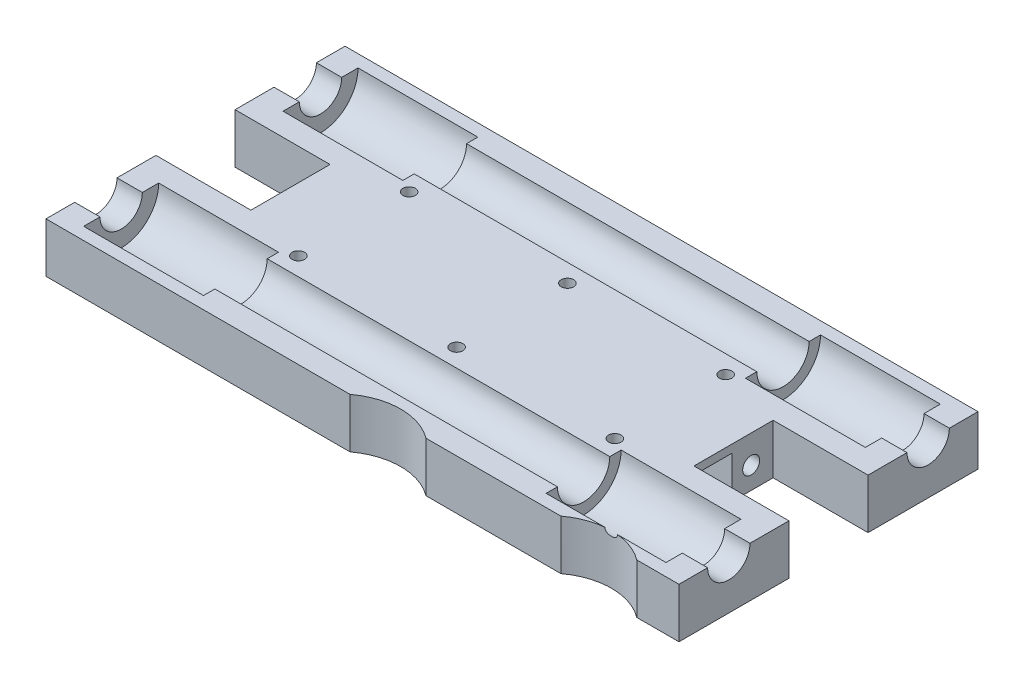
from build123d import *

# Parameters (mm, degrees)
SKETCH1_W                      = 127
SKETCH1_H                      = 60
BOSS_EXTRUDE1_DEPTH            = 10
CUT_EXTRUDE1_START             = -5.08
SKETCH3_R                      = 7.525
CUT_EXTRUDE1_DEPTH             = 24.05
CUT_EXTRUDE2_REACH             = 127.954
SKETCH4_R                      = 4.25
CUT_EXTRUDE2_DIRECTION_2_REACH = 127.954
CUT_EXTRUDE3_START             = -68.74
SKETCH5_R                      = 5.25
SKETCH5_R_2                    = 4.25
CUT_EXTRUDE3_DEPTH             = 68.74
SKETCH6_W                      = 15.875
SKETCH6_H                      = 10
CUT_EXTRUDE4_DEPTH             = 19.05
M3_CLEARANCE_HOLE1_D           = 3.4
CUT_EXTRUDE5_START             = -6.35
CUT_EXTRUDE5_DEPTH             = 5
M3X0_5_TAPPED_HOLE1_D          = 2.5
SKETCH12_W                     = 7.62
SKETCH12_H                     = 8.4125
CUT_EXTRUDE6_DEPTH             = 113.48645474
CUT_EXTRUDE7_REACH             = 72.938
SKETCH13_R                     = 12.7


with BuildPart() as part:
    # Sketch1 → Boss-Extrude1 (new body)
    with BuildSketch(Plane(origin=(0, 0, 0), x_dir=(1, 0, 0), z_dir=(0, 1, 0))):
        Rectangle(SKETCH1_W, SKETCH1_H)
    extrude(amount=BOSS_EXTRUDE1_DEPTH)

    # Sketch3 → Cut-Extrude1 (cut)
    with BuildSketch(Plane.ZY.offset(63.5).offset(CUT_EXTRUDE1_START)):
        with Locations((-20, 10)):
            Circle(SKETCH3_R)
        with Locations((20, 10)):
            Circle(SKETCH3_R)
    cut_extrude1 = extrude(amount=-CUT_EXTRUDE1_DEPTH, mode=Mode.SUBTRACT)

    # Mirror1: Cut-Extrude1 across plane
    add(cut_extrude1.mirror(Plane(origin=(0, 0, 0), x_dir=(0, 0, 1), z_dir=(1, 0, 0))), mode=Mode.SUBTRACT)

    # Sketch4 → Cut-Extrude2 (cut, up to next)
    with BuildSketch(Plane(origin=(-58.42, 0, 0), x_dir=(0, 0, -1), z_dir=(1, 0, 0)), mode=Mode.PRIVATE) as cut_extrude2_sk1:
        with Locations((20, 10)):
            Circle(SKETCH4_R)
    cut_extrude2_tool1 = extrude(cut_extrude2_sk1.sketch, amount=-CUT_EXTRUDE2_REACH, mode=Mode.PRIVATE) & part.part
    cut_extrude2 = cut_extrude2_tool1.solids().sort_by_distance((-58.42, 10, -20))[0]
    add(cut_extrude2, mode=Mode.SUBTRACT)

    # Cut-Extrude2 direction 2: up to this face of the body (flat: up to its plane)
    cut_extrude2_direction_2_end = Plane(part.part.faces().sort_by_distance((63.5, 5, 0))[0])
    # Sketch4 → Cut-Extrude2 direction 2 (cut, up to the picked face)
    with BuildSketch(Plane(origin=(-58.42, 0, 0), x_dir=(0, 0, -1), z_dir=(1, 0, 0)), mode=Mode.PRIVATE) as cut_extrude2_direction_2_sk1:
        with Locations((20, 10)):
            Circle(SKETCH4_R)
    cut_extrude2_direction_2_tool1 = split(extrude(cut_extrude2_direction_2_sk1.sketch, amount=CUT_EXTRUDE2_DIRECTION_2_REACH, mode=Mode.PRIVATE), bisect_by=cut_extrude2_direction_2_end, keep=Keep.BOTH, mode=Mode.PRIVATE)
    cut_extrude2_direction_2 = cut_extrude2_direction_2_tool1.solids().sort_by(Axis((-58.42, 10, -20), (1, 0, 0)))[0]
    add(cut_extrude2_direction_2, mode=Mode.SUBTRACT)

    # Mirror2: Cut-Extrude2, Cut-Extrude2 direction 2 across plane
    add(cut_extrude2.mirror(Plane.XY), mode=Mode.SUBTRACT)
    add(cut_extrude2_direction_2.mirror(Plane.XY), mode=Mode.SUBTRACT)

    # Sketch5 → Cut-Extrude3 (cut)
    with BuildSketch(Plane(origin=(34.37, 0, 0), x_dir=(0, 0, -1), z_dir=(1, 0, 0)).offset(CUT_EXTRUDE3_START)):
        with Locations((-20, 10)):
            Circle(SKETCH5_R)
        with Locations((-20, 10)):
            Circle(SKETCH5_R_2, mode=Mode.SUBTRACT)
    cut_extrude3 = extrude(amount=CUT_EXTRUDE3_DEPTH, mode=Mode.SUBTRACT)

    # Mirror3: Cut-Extrude3 across plane
    add(cut_extrude3.mirror(Plane.XY), mode=Mode.SUBTRACT)

    # Sketch6 → Cut-Extrude4 (cut)
    with BuildSketch(Plane.ZY.offset(63.5)):
        with Locations((0, 5)):
            Rectangle(SKETCH6_W, SKETCH6_H)
    cut_extrude4 = extrude(amount=-CUT_EXTRUDE4_DEPTH, mode=Mode.SUBTRACT)

    # Mirror4: Cut-Extrude4 across plane
    add(cut_extrude4.mirror(Plane(origin=(0, 0, 0), x_dir=(0, 0, 1), z_dir=(1, 0, 0))), mode=Mode.SUBTRACT)

    # M3 Clearance Hole1 (through all)
    with Locations(Plane.ZY.offset(44.45)):
        with Locations((-3.5375, 4.4)):
            Hole(M3_CLEARANCE_HOLE1_D / 2)

    # Sketch9 → Cut-Extrude5 (cut)
    with BuildSketch(Plane.ZY.offset(44.45).offset(CUT_EXTRUDE5_START)):
        Polygon((-0.7875, 0), (-0.7875, 5.98771324), (-3.5375, 7.575426481), (-6.2875, 5.98771324), (-6.2875, 0), align=None)
    cut_extrude5 = extrude(amount=-CUT_EXTRUDE5_DEPTH, mode=Mode.SUBTRACT)

    # Mirror5: Cut-Extrude5 across plane
    add(cut_extrude5.mirror(Plane(origin=(0, 0, 0), x_dir=(0, 0, 1), z_dir=(1, 0, 0))), mode=Mode.SUBTRACT)

    # M3x0.5 Tapped Hole1 (through all)
    with Locations(Plane(origin=(0, 10, 0), x_dir=(1, 0, 0), z_dir=(0, 1, 0))):
        with Locations((-31.75, -11.1125), (31.75, -11.1125), (-31.75, 11.1125), (31.75, 11.1125), (0, -11.1125), (0, 11.1125)):
            Hole(M3X0_5_TAPPED_HOLE1_D / 2)

    # Sketch12 → Cut-Extrude6 (cut, through all)
    with BuildSketch(Plane.ZY.offset(44.45)):
        with Locations((4.1275, 4.20625)):
            Rectangle(SKETCH12_W, SKETCH12_H)
    extrude(amount=-CUT_EXTRUDE6_DEPTH, mode=Mode.SUBTRACT)

    # Sketch13 → Cut-Extrude7 (cut, up to next)
    with BuildSketch(Plane.XZ, mode=Mode.PRIVATE) as cut_extrude7_sk1:
        with Locations((5.1218, 40.16)):
            Circle(SKETCH13_R)
    cut_extrude7_tool1 = extrude(cut_extrude7_sk1.sketch, amount=-CUT_EXTRUDE7_REACH, mode=Mode.PRIVATE) & part.part
    # Sketch13 → Cut-Extrude7 (cut, up to next)
    with BuildSketch(Plane.XZ, mode=Mode.PRIVATE) as cut_extrude7_sk2:
        with Locations((47.4218, 40.16)):
            Circle(SKETCH13_R)
    cut_extrude7_tool2 = extrude(cut_extrude7_sk2.sketch, amount=-CUT_EXTRUDE7_REACH, mode=Mode.PRIVATE) & part.part
    add(cut_extrude7_tool1.solids().sort_by_distance((5.1218, 0, 40.16))[0], mode=Mode.SUBTRACT)
    add(cut_extrude7_tool2.solids().sort_by_distance((47.4218, 0, 40.16))[0], mode=Mode.SUBTRACT)


solid = part.part
